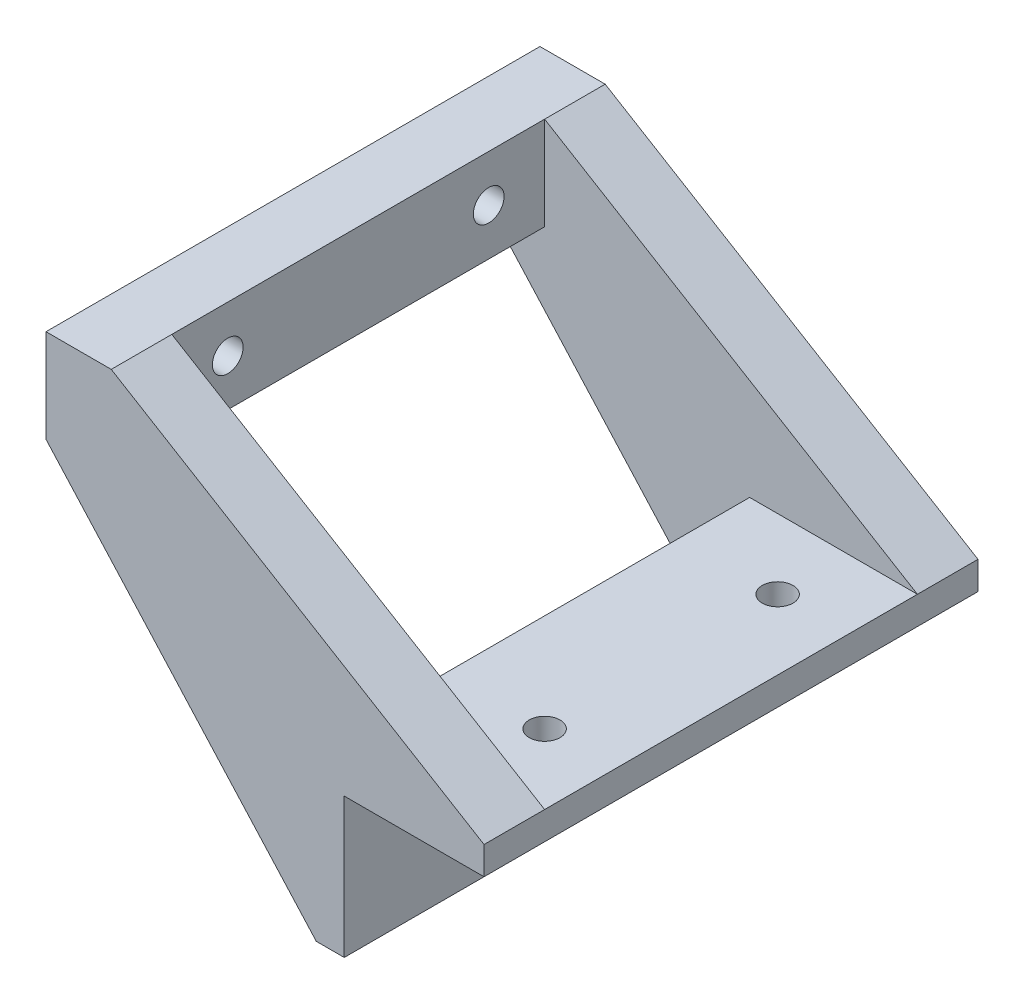
from build123d import *

# Parameters (mm, degrees)
BOSS_EXTRUDE1_DEPTH = 26.5
SKETCH3_W           = 53
SKETCH3_H           = 10
SKETCH3_R           = 1.65
BOSS_EXTRUDE2_DEPTH = 7
CUT_EXTRUDE1_REACH  = 62.402
SKETCH4_W           = 40
SKETCH4_H           = 24.15
CUT_EXTRUDE2_START  = -32.15
SKETCH5_W           = 45
SKETCH5_H           = 40
CUT_EXTRUDE2_DEPTH  = 32.15
SKETCH7_R           = 1.65
CUT_EXTRUDE4_DEPTH  = 3
SKETCH8_R           = 1.65
CUT_EXTRUDE5_DEPTH  = 3
BOSS_EXTRUDE3_REACH = 52.348
SKETCH9_W           = 40
SKETCH9_H           = 4.688556191


with BuildPart() as part:
    # Sketch1 → Boss-Extrude1 (new, symmetric)
    with BuildSketch(Plane.XY):
        Polygon((15, 0), (0, 0), (0, -15), (-3, -15), (-32, 17.15), (-25, 17.15), (-25, 27.15), (15, 3), align=None)
    extrude(amount=BOSS_EXTRUDE1_DEPTH, both=True)

    # Sketch3 → Boss-Extrude2 (add)
    with BuildSketch(Plane.ZY.offset(25)):
        with Locations((0, 22.15)):
            Rectangle(SKETCH3_W, SKETCH3_H)
        with Locations(Location((-14, 22.15, 0), (0, 0, 270))):
            Circle(SKETCH3_R, mode=Mode.SUBTRACT)
        with Locations(Location((14, 22.15, 0), (0, 0, 270))):
            Circle(SKETCH3_R, mode=Mode.SUBTRACT)
    extrude(amount=BOSS_EXTRUDE2_DEPTH)

    # Cut-Extrude1: up to this face of the body (flat: up to its plane)
    cut_extrude1_end = Plane(part.part.faces().sort_by_distance((-25, 22.15, -14))[0])
    # Sketch4 → Cut-Extrude1 (cut, up to the picked face)
    with BuildSketch(Plane(origin=(15, 0, 0), x_dir=(0, 0, -1), z_dir=(1, 0, 0)), mode=Mode.PRIVATE) as cut_extrude1_sk1:
        with Locations((0, 15.075)):
            Rectangle(SKETCH4_W, SKETCH4_H)
    cut_extrude1_tool1 = split(extrude(cut_extrude1_sk1.sketch, amount=-CUT_EXTRUDE1_REACH, mode=Mode.PRIVATE), bisect_by=cut_extrude1_end, keep=Keep.BOTH, mode=Mode.PRIVATE)
    add(cut_extrude1_tool1.solids().sort_by(Axis((15, 15.075, 0), (-1, 0, 0)))[0], mode=Mode.SUBTRACT)

    # Sketch5 → Cut-Extrude2 (cut)
    with BuildSketch(Plane.XZ.offset(15).offset(CUT_EXTRUDE2_START)):
        with Locations((-25.5, 0)):
            Rectangle(SKETCH5_W, SKETCH5_H)
    extrude(amount=CUT_EXTRUDE2_DEPTH, mode=Mode.SUBTRACT)

    # Sketch7 → Cut-Extrude4 (cut)
    with BuildSketch(Plane(origin=(0, 0, 0), x_dir=(0, 0, -1), z_dir=(1, 0, 0))):
        with Locations(Location((-5, -7.5, 0), (0, 0, 90))):
            Circle(SKETCH7_R)
        with Locations(Location((5, -7.5, 0), (0, 0, 90))):
            Circle(SKETCH7_R)
    extrude(amount=-CUT_EXTRUDE4_DEPTH, mode=Mode.SUBTRACT)

    # Sketch8 → Cut-Extrude5 (cut)
    with BuildSketch(Plane.XZ):
        with Locations((7.5, 12.5)):
            Circle(SKETCH8_R)
        with Locations((7.5, -12.5)):
            Circle(SKETCH8_R)
    extrude(amount=-CUT_EXTRUDE5_DEPTH, mode=Mode.SUBTRACT)

    # Boss-Extrude3: up to this face of the body (flat: up to its plane)
    boss_extrude3_end = Plane(part.part.faces().sort_by_distance((-28.5, 17.15, 0))[0])
    # Sketch9 → Boss-Extrude3 (add, up to the picked face)
    with BuildSketch(Plane(origin=(-9.114431039, -8.221415245, 0), x_dir=(0, 0, 1), z_dir=(-0.7425471996920773, -0.669793741557395, 0)), mode=Mode.PRIVATE) as boss_extrude3_sk1:
        with Locations((0, 31.82380611)):
            Rectangle(SKETCH9_W, SKETCH9_H)
    boss_extrude3_tool1 = split(extrude(boss_extrude3_sk1.sketch, amount=-BOSS_EXTRUDE3_REACH, mode=Mode.PRIVATE), bisect_by=boss_extrude3_end, keep=Keep.BOTH, mode=Mode.PRIVATE)
    add(boss_extrude3_tool1.solids().sort_by(Axis((-30.429817, 15.409263, 0), (0.7425471996920773, 0.669793741557395, 0)))[0])


solid = part.part
